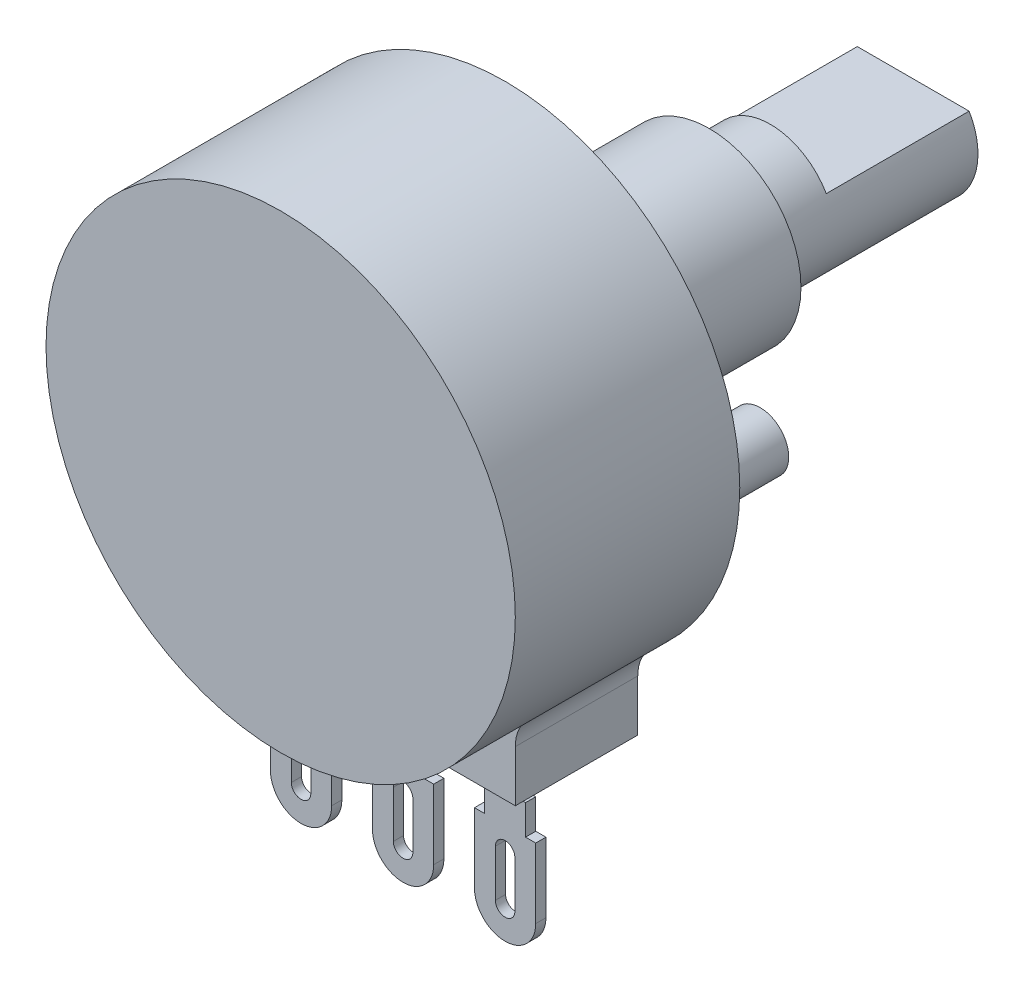
from build123d import *

# Parameters (mm, degrees)
SKETCH2_R           = 1.4
BOSS_EXTRUDE1_DEPTH = 2.5
SKETCH3_W           = 13
SKETCH3_H           = 4.686630076
BOSS_EXTRUDE3_DEPTH = 6
FILLET1_R           = 2
BOSS_EXTRUDE4_DEPTH = 0.5
CUT_EXTRUDE1_DEPTH  = 7


with BuildPart() as part:
    # Sketch1 → Revolve1 (revolve)
    with BuildSketch(Plane(origin=(0, 0, 0), x_dir=(0, 0, -1), z_dir=(1, 0, 0)), mode=Mode.PRIVATE) as revolve1_sk:
        Polygon((0, 0), (0, 11.5), (11, 11.5), (11, 4.5), (21, 4.5), (21, 3.175), (31, 3.175), (31, 0), align=None)
    revolve(revolve1_sk.sketch.rotate(Axis((0, 0, 0), (0, 0, -1)), 90), axis=Axis((0, 0, 0), (0, 0, -1)))

    # Sketch2 → Boss-Extrude1 (add)
    with BuildSketch(Plane(origin=(0, 0, -11), x_dir=(-1, 0, 0), z_dir=(0, 0, -1))):
        with Locations(Location((-10, 0, 0), (0, 0, 180))):
            Circle(SKETCH2_R)
    extrude(amount=BOSS_EXTRUDE1_DEPTH)

    # Sketch3 → Boss-Extrude3 (add)
    with BuildSketch(Plane(origin=(0, 0, -5), x_dir=(-1, 0, 0), z_dir=(0, 0, -1))):
        with Locations((0, -10.656684962)):
            Rectangle(SKETCH3_W, SKETCH3_H)
    extrude(amount=BOSS_EXTRUDE3_DEPTH)

    # Fillet1
    fillet1_edges = [part.edges().sort_by_distance(p)[0] for p in [
        (6.5, -9.486832981, -8),
        (-6.5, -9.486832981, -8),
    ]]
    fillet(fillet1_edges, radius=FILLET1_R)

    # Sketch4 → Boss-Extrude4 (add)
    # profile 1 of 3: a face of its own
    with BuildSketch(Plane(origin=(0, 0, -6), x_dir=(-1, 0, 0), z_dir=(0, 0, -1))):
        with BuildLine():
            Line((-5.420458078, -13), (-5.420458078, -13.616327338))
            Line((-5.420458078, -13.616327338), (-6, -13.616327338))
            Line((-6, -13.616327338), (-6, -15.080506085))
            Line((-6, -15.080506085), (-6.5, -15.080506085))
            Line((-6.5, -15.080506085), (-6.5, -18.5))
            ThreePointArc((-6.5, -18.5), (-5, -20), (-3.5, -18.5))
            Line((-3.5, -18.5), (-3.5, -15.080506085))
            Line((-3.5, -15.080506085), (-4, -15.080506085))
            Line((-4, -15.080506085), (-4, -13.616327338))
            Line((-4, -13.616327338), (-3.420458078, -13.616327338))
            Line((-3.420458078, -13.616327338), (-3.420458078, -13))
            Line((-3.420458078, -13), (-5.420458078, -13))
        make_face()
        with BuildLine():
            Line((-5.477176785, -18.5), (-5.477176785, -16.20237717))
            ThreePointArc((-5.477176785, -16.20237717), (-5, -15.725200384), (-4.522823215, -16.20237717))
            Line((-4.522823215, -16.20237717), (-4.522823215, -18.5))
            ThreePointArc((-4.522823215, -18.5), (-5, -18.977176785), (-5.477176785, -18.5))
        make_face(mode=Mode.SUBTRACT)
    # profile 2 of 3: a face of its own
    with BuildSketch(Plane(origin=(0, 0, -6), x_dir=(-1, 0, 0), z_dir=(0, 0, -1))):
        with BuildLine():
            Line((-1.5, -18.5), (-1.5, -15.080506085))
            Line((-1.5, -15.080506085), (-1, -15.080506085))
            Line((-1, -15.080506085), (-1, -13.616327338))
            Line((-1, -13.616327338), (-1.5, -13.616327338))
            Line((-1.5, -13.616327338), (-1.5, -13))
            Line((-1.5, -13), (1.5, -13))
            Line((1.5, -13), (1.5, -13.616327338))
            Line((1.5, -13.616327338), (1, -13.616327338))
            Line((1, -13.616327338), (1, -15.080506085))
            Line((1, -15.080506085), (1.5, -15.080506085))
            Line((1.5, -15.080506085), (1.5, -18.5))
            ThreePointArc((1.5, -18.5), (0, -20), (-1.5, -18.5))
        make_face()
        with BuildLine():
            Line((-0.477176785, -18.5), (-0.477176785, -16.20237717))
            ThreePointArc((-0.477176785, -16.20237717), (0, -15.725200384), (0.477176785, -16.20237717))
            Line((0.477176785, -16.20237717), (0.477176785, -18.5))
            ThreePointArc((0.477176785, -18.5), (0, -18.977176785), (-0.477176785, -18.5))
        make_face(mode=Mode.SUBTRACT)
    # profile 3 of 3: a face of its own
    with BuildSketch(Plane(origin=(0, 0, -6), x_dir=(-1, 0, 0), z_dir=(0, 0, -1))):
        with BuildLine():
            Line((3.420458078, -13.616327338), (3.420458078, -13))
            Line((3.420458078, -13), (5.420458078, -13))
            Line((5.420458078, -13), (5.420458078, -13.616327338))
            Line((5.420458078, -13.616327338), (6, -13.616327338))
            Line((6, -13.616327338), (6, -15.080506085))
            Line((6, -15.080506085), (6.5, -15.080506085))
            Line((6.5, -15.080506085), (6.5, -18.5))
            ThreePointArc((6.5, -18.5), (5, -20), (3.5, -18.5))
            Line((3.5, -18.5), (3.5, -15.080506085))
            Line((3.5, -15.080506085), (4, -15.080506085))
            Line((4, -15.080506085), (4, -13.616327338))
            Line((4, -13.616327338), (3.420458078, -13.616327338))
        make_face()
        with BuildLine():
            Line((4.522823215, -18.5), (4.522823215, -16.20237717))
            ThreePointArc((4.522823215, -16.20237717), (5, -15.725200384), (5.477176785, -16.20237717))
            Line((5.477176785, -16.20237717), (5.477176785, -18.5))
            ThreePointArc((5.477176785, -18.5), (5, -18.977176785), (4.522823215, -18.5))
        make_face(mode=Mode.SUBTRACT)
    extrude(amount=BOSS_EXTRUDE4_DEPTH)

    # Sketch5 → Cut-Extrude1 (cut)
    with BuildSketch(Plane(origin=(0, 0, -31), x_dir=(-1, 0, 0), z_dir=(0, 0, -1))):
        with BuildLine():
            Line((-2.740543661, 1.603136127), (2.740543661, 1.603136127))
            ThreePointArc((2.740543661, 1.603136127), (0, 3.175), (-2.740543661, 1.603136127))
        make_face()
    extrude(amount=-CUT_EXTRUDE1_DEPTH, mode=Mode.SUBTRACT)


solid = part.part
